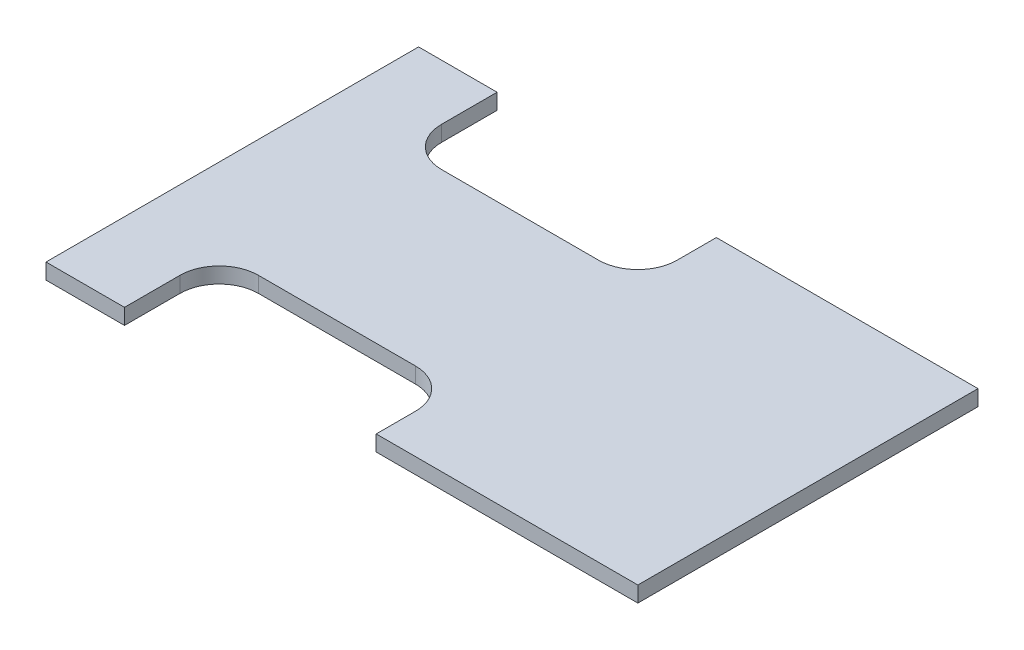
from build123d import *

# Parameters (mm, degrees)
SKETCH1_W           = 220
SKETCH1_H           = 130
BOSS_EXTRUDE1_DEPTH = 6
SKETCH2_W           = 90
SKETCH2_H           = 30
CUT_EXTRUDE1_DEPTH  = 128.910124697
FILLET1_R           = 15
SKETCH3_W           = 30
SKETCH3_H           = 6.2
BOSS_EXTRUDE2_DEPTH = 6


with BuildPart() as part:
    # Sketch1 → Boss-Extrude1 (new body)
    with BuildSketch(Plane(origin=(0, 0, 0), x_dir=(1, 0, 0), z_dir=(0, 1, 0))):
        Rectangle(SKETCH1_W, SKETCH1_H)
    extrude(amount=BOSS_EXTRUDE1_DEPTH)

    # Sketch2 → Cut-Extrude1 (cut, through all)
    with BuildSketch(Plane(origin=(0, 6, 0), x_dir=(1, 0, 0), z_dir=(0, 1, 0))):
        with Locations((-35, -50)):
            Rectangle(SKETCH2_W, SKETCH2_H)
        with Locations((-35, 50)):
            Rectangle(SKETCH2_W, SKETCH2_H)
    extrude(amount=-CUT_EXTRUDE1_DEPTH, mode=Mode.SUBTRACT)

    # Fillet1
    fillet1_edges = [part.edges().sort_by_distance(p)[0] for p in [
        (-80, 3, 35),
        (10, 3, 35),
        (-80, 3, -35),
        (10, 3, -35),
    ]]
    fillet(fillet1_edges, radius=FILLET1_R)

    # Sketch3 → Boss-Extrude2 (add)
    with BuildSketch(Plane(origin=(0, 6, 0), x_dir=(1, 0, 0), z_dir=(0, 1, 0))):
        with Locations((-95, 68.1)):
            Rectangle(SKETCH3_W, SKETCH3_H)
        with Locations((-95, -68.1)):
            Rectangle(SKETCH3_W, SKETCH3_H)
    extrude(amount=-BOSS_EXTRUDE2_DEPTH)


solid = part.part
